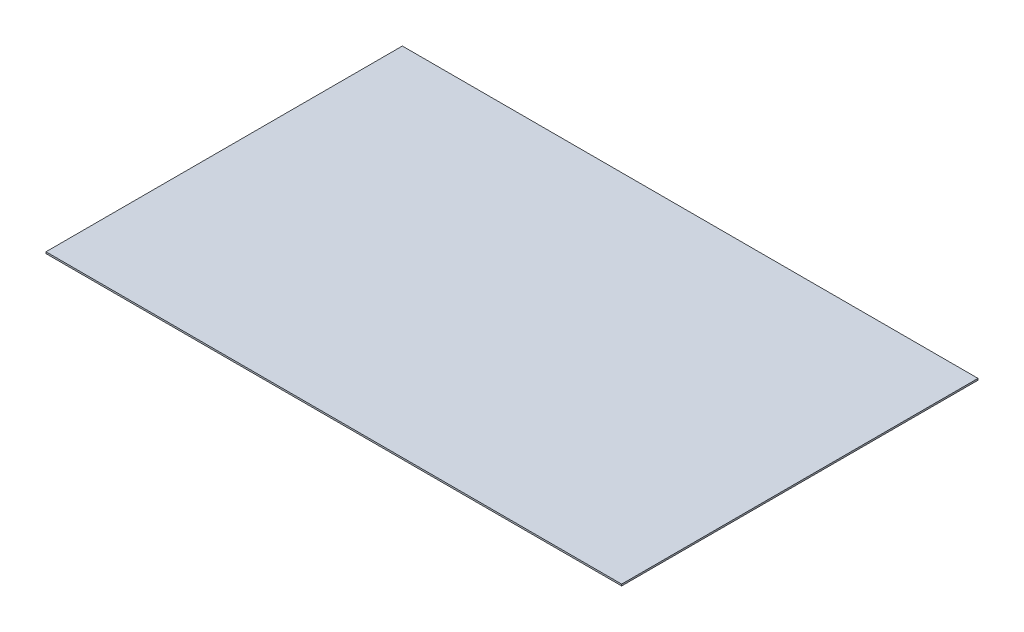
from build123d import *

# Parameters (mm, degrees)
SKETCH_1_W      = 1050
SKETCH_1_H      = 650
EXTRUDE_1_DEPTH = 3


with BuildPart() as part:
    # 草图1 → 凸台-拉伸1 (new body)
    with BuildSketch(Plane(origin=(0, 0, 0), x_dir=(1, 0, 0), z_dir=(0, 1, 0))):
        Rectangle(SKETCH_1_W, SKETCH_1_H)
    extrude(amount=EXTRUDE_1_DEPTH)


solid = part.part
